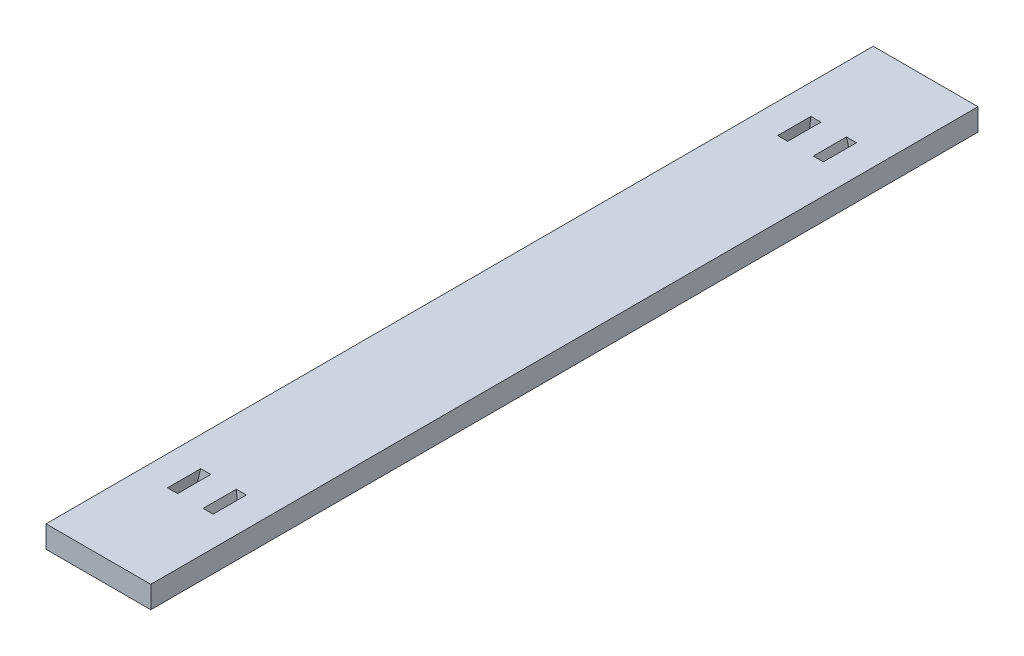
from build123d import *

# Parameters (mm, degrees)
SKETCH_1_W               = 190
SKETCH_1_H               = 40
EXTRUDE_1_DEPTH          = 1500
SKETCH_4_W               = 18.18
SKETCH_4_H               = 60.16888381
CUT_EXTRUDE_1_DEPTH      = 1500
MIRROR_2_COPY_1_SKETCH_W = 18.18
MIRROR_2_COPY_1_SKETCH_H = 60.16888381
MIRROR_2_COPY_1_DEPTH    = 1500
MIRROR_2_COPY_2_SKETCH_W = 18.18
MIRROR_2_COPY_2_SKETCH_H = 60.16888381
MIRROR_2_COPY_2_DEPTH    = 1500


with BuildPart() as part:
    # 草圖1 → 填料-伸長1 (new body)
    with BuildSketch(Plane.XY):
        with Locations((95, -20)):
            Rectangle(SKETCH_1_W, SKETCH_1_H)
    extrude(amount=-EXTRUDE_1_DEPTH)

    # 草圖4 → 除料-伸長1 (cut, along a direction that is not the sketch's normal)
    with BuildSketch(Plane(origin=(0, 0, 0), x_dir=(1, 0, 0), z_dir=(0, 1, 0))):
        with Locations((127.243345581, 196.784441905)):
            Rectangle(SKETCH_4_W, SKETCH_4_H)
    cut_extrude_1 = extrude(amount=-CUT_EXTRUDE_1_DEPTH, dir=(-0.18489307241243372, 0.9800002075530074, -0.07358087366940451), mode=Mode.SUBTRACT)

    # 鏡射1: 除料-伸長1 across plane
    add(cut_extrude_1.mirror(Plane.XY.offset(-750)), mode=Mode.SUBTRACT)

    # 鏡射2 copy 1 sketch → 鏡射2 copy 1 (cut, along a direction that is not the sketch's normal)
    with BuildSketch(Plane(origin=(190, 0, -1500), x_dir=(-1, 0, 0), z_dir=(0, 1, 0))):
        with Locations((127.243345581, 196.784441905)):
            Rectangle(MIRROR_2_COPY_1_SKETCH_W, MIRROR_2_COPY_1_SKETCH_H)
    extrude(amount=-MIRROR_2_COPY_1_DEPTH, dir=(0.18489307241243372, 0.9800002075530074, 0.07358087366940451), mode=Mode.SUBTRACT)

    # 鏡射2 copy 2 sketch → 鏡射2 copy 2 (cut, along a direction that is not the sketch's normal)
    with BuildSketch(Plane(origin=(190, 0, 0), x_dir=(-1, 0, 0), z_dir=(0, 1, 0))):
        with Locations((127.243345581, -196.784441905)):
            Rectangle(MIRROR_2_COPY_2_SKETCH_W, MIRROR_2_COPY_2_SKETCH_H)
    extrude(amount=-MIRROR_2_COPY_2_DEPTH, dir=(0.18489307241243372, 0.9800002075530074, -0.07358087366940451), mode=Mode.SUBTRACT)


solid = part.part
